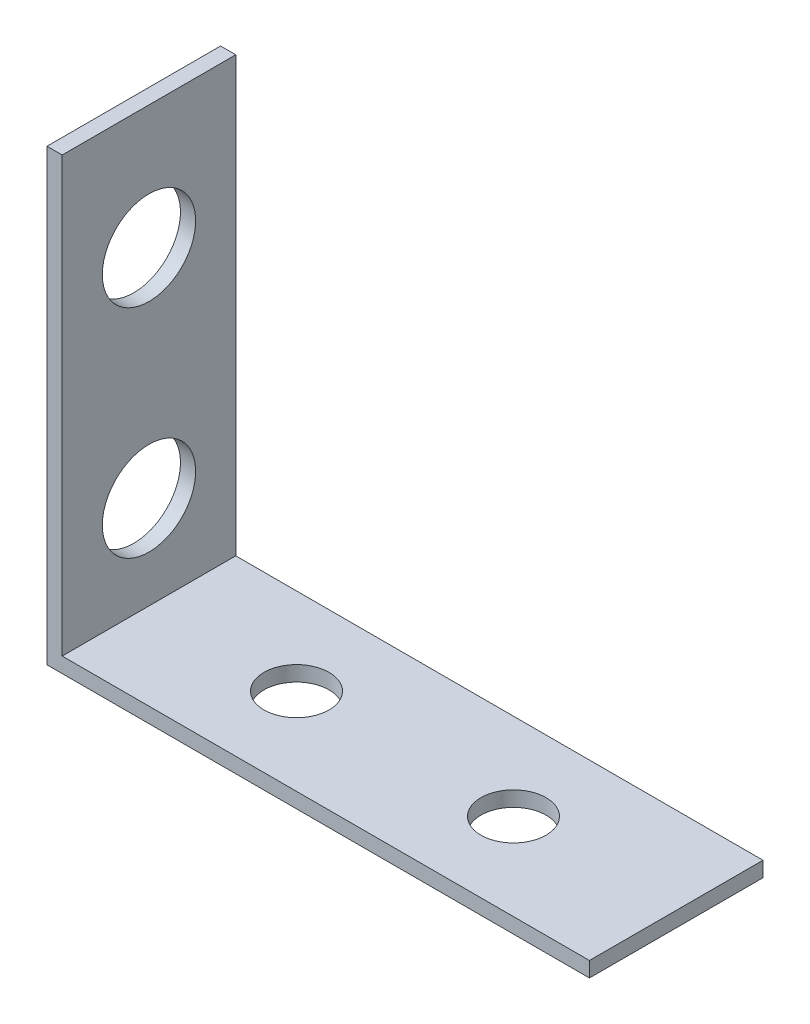
from build123d import *

# Parameters (mm, degrees)
BOSS_EXTRUDE1_DEPTH = 0.7
SKETCH3_W           = 0.7
SKETCH3_H           = 8
BOSS_EXTRUDE3_DEPTH = 20
SKETCH4_R           = 2.15
CUT_EXTRUDE1_DEPTH  = 34.42887973


with BuildPart() as part:
    # Sketch1 → Boss-Extrude1 (new body)
    with BuildSketch(Plane(origin=(0, 0, 0), x_dir=(1, 0, 0), z_dir=(0, 1, 0))):
        with BuildLine():
            Line((0, 0), (0, 4))
            Line((0, 4), (-3.5, 4))
            ThreePointArc((-3.5, 4), (-5, 2.5), (-6.5, 4))
            Line((-6.5, 4), (-12.5, 4))
            Line((-12.5, 4), (-12.5, 0))
            Line((-12.5, 0), (0, 0))
        make_face()
        with BuildLine():
            Line((12.5, 4), (6.5, 4))
            ThreePointArc((6.5, 4), (5, 2.5), (3.5, 4))
            Line((3.5, 4), (0, 4))
            Line((0, 4), (0, 0))
            Line((0, 0), (12.5, 0))
            Line((12.5, 0), (12.5, 4))
        make_face()
        with BuildLine():
            ThreePointArc((3.5, 4), (5, 5.5), (6.5, 4))
            Line((6.5, 4), (12.5, 4))
            Line((12.5, 4), (12.5, 8))
            Line((12.5, 8), (0, 8))
            Line((0, 8), (0, 4))
            Line((0, 4), (3.5, 4))
        make_face()
        with BuildLine():
            Line((-3.5, 4), (0, 4))
            Line((0, 4), (0, 8))
            Line((0, 8), (-12.5, 8))
            Line((-12.5, 8), (-12.5, 4))
            Line((-12.5, 4), (-6.5, 4))
            ThreePointArc((-6.5, 4), (-5, 5.5), (-3.5, 4))
        make_face()
    extrude(amount=BOSS_EXTRUDE1_DEPTH)

    # Sketch3 → Boss-Extrude3 (add)
    with BuildSketch(Plane(origin=(0, 0.7, 0), x_dir=(1, 0, 0), z_dir=(0, 1, 0))):
        with Locations((-12.15, 4)):
            Rectangle(SKETCH3_W, SKETCH3_H)
    extrude(amount=BOSS_EXTRUDE3_DEPTH)

    # Sketch4 → Cut-Extrude1 (cut, through all)
    with BuildSketch(Plane.ZY.offset(12.5)):
        with Locations((-4, 5)):
            Circle(SKETCH4_R)
        with Locations((-4, 15)):
            Circle(SKETCH4_R)
    extrude(amount=-CUT_EXTRUDE1_DEPTH, mode=Mode.SUBTRACT)


solid = part.part
